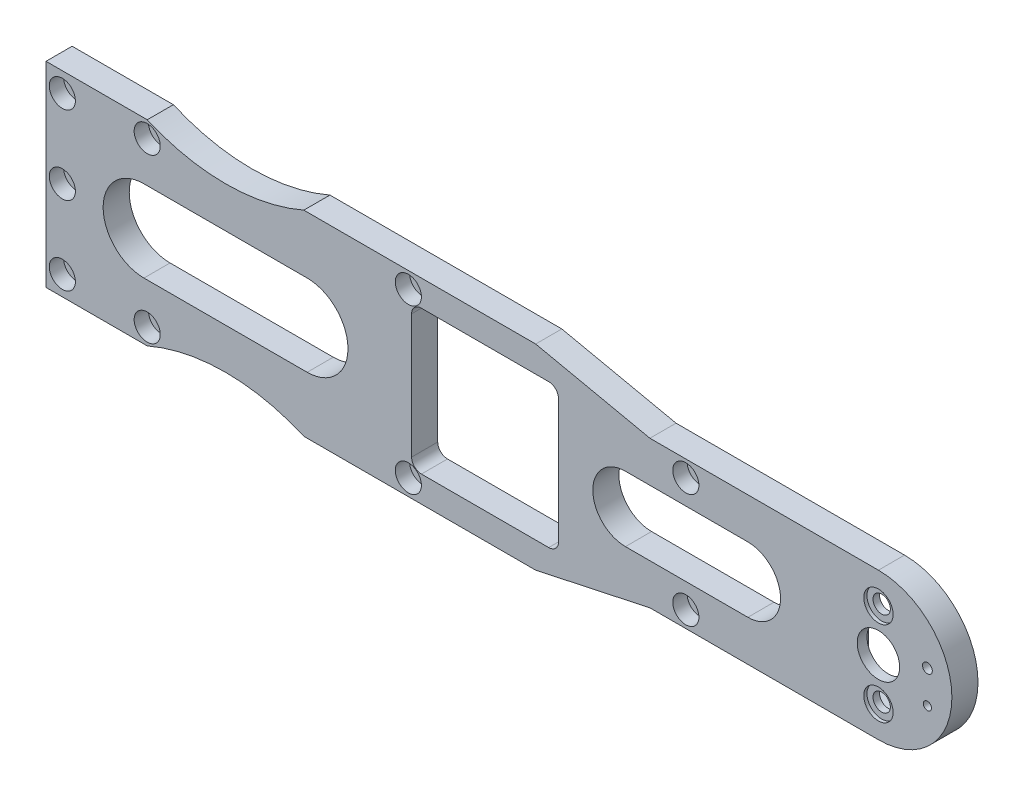
from build123d import *

# Parameters (mm, degrees)
SKETCH_1_W                   = 45
SKETCH_1_H                   = 44
EXTRUDE_1_DEPTH              = 8
CUT_EXTRUDE_1_DEPTH          = 10
FILLET_1_R                   = 3
HOLE_WIZARD_M4_1_D           = 4.5
HOLE_WIZARD_M4_1_CBORE_D     = 8
HOLE_WIZARD_M4_1_CBORE_DEPTH = 4.4
CUT_EXTRUDE_2_DEPTH          = 4
FILLET_2_R                   = 1.5
HOLE_WIZARD_13_0_13_1_D      = 13
HOLE_WIZARD_13_0_13_1_DEPTH  = 12
HOLE_WIZARD_13_0_13_1_TIP    = 3.905594024
CUT_EXTRUDE_3_DEPTH          = 5
HOLE_WIZARD_5_3_5_3_1_D      = 5.3
HOLE_WIZARD_5_3_5_3_1_DEPTH  = 12
HOLE_WIZARD_5_3_5_3_1_TIP    = 1.59228064
SKETCH_19_R                  = 4.5
CUT_EXTRUDE_4_DEPTH          = 1
HOLE_WIZARD_M3_1_D           = 2.5
HOLE_WIZARD_3_0_3_1_D        = 3
HOLE_WIZARD_3_0_3_1_DEPTH    = 40
HOLE_WIZARD_3_0_3_1_TIP      = 0.901290929
FILLET_3_R                   = 1.5


with BuildPart() as part:
    # 草图1 → 凸台-拉伸1 (new body)
    with BuildSketch(Plane.XY):
        with BuildLine():
            Line((128.173730269, 22.5), (58.173730269, 22.5))
            Line((58.173730269, 22.5), (23.173730269, 30))
            Line((23.173730269, 30), (-47.847112114, 30))
            ThreePointArc((-47.847112114, 30), (-71.826269731, 25), (-95.805427348, 30))
            Line((-95.805427348, 30), (-126.826269731, 30))
            Line((-126.826269731, 30), (-126.826269731, -30))
            Line((-126.826269731, -30), (-95.805427348, -30))
            ThreePointArc((-95.805427348, -30), (-71.826269731, -25), (-47.847112114, -30))
            Line((-47.847112114, -30), (23.173730269, -30))
            Line((23.173730269, -30), (58.173730269, -22.5))
            Line((58.173730269, -22.5), (128.173730269, -22.5))
            ThreePointArc((128.173730269, -22.5), (150.673730269, 0), (128.173730269, 22.5))
        make_face()
        with BuildLine():
            Line((-96.826269731, 12.5), (-46.826269731, 12.5))
            ThreePointArc((-46.826269731, 12.5), (-34.326269731, 0), (-46.826269731, -12.5))
            Line((-46.826269731, -12.5), (-96.826269731, -12.5))
            ThreePointArc((-96.826269731, -12.5), (-109.326269731, 0), (-96.826269731, 12.5))
        make_face(mode=Mode.SUBTRACT)
        with Locations((7.673730269, 0)):
            Rectangle(SKETCH_1_W, SKETCH_1_H, mode=Mode.SUBTRACT)
    extrude(amount=EXTRUDE_1_DEPTH)

    # 草图2 → 切除-拉伸1 (cut)
    with BuildSketch(Plane.XY.offset(8)):
        with BuildLine():
            Line((50.673730269, 10), (88.173730269, 10))
            ThreePointArc((88.173730269, 10), (98.173730269, 0), (88.173730269, -10))
            Line((88.173730269, -10), (50.673730269, -10))
            ThreePointArc((50.673730269, -10), (40.673730269, 0), (50.673730269, 10))
        make_face()
    extrude(amount=-CUT_EXTRUDE_1_DEPTH, mode=Mode.SUBTRACT)

    # 圆角1
    fillet_1_edges = [part.edges().sort_by_distance(p)[0] for p in [
        (-14.826269731, 22, 4),
        (-14.826269731, -22, 4),
        (30.173730269, -22, 4),
        (30.173730269, 22, 4),
    ]]
    fillet(fillet_1_edges, radius=FILLET_1_R)

    # M4 六角凹头螺钉的柱形沉头孔1 (through all)
    with Locations(Plane.XY.offset(8)):
        with Locations((-121.826269731, 0), (-121.826269731, -24), (-121.826269731, 24), (-95.826269731, 25), (-95.826269731, -25), (-15.826269731, -25), (-15.826269731, 25), (69.173730269, 17.5), (69.173730269, -17.5)):
            CounterBoreHole(HOLE_WIZARD_M4_1_D / 2, HOLE_WIZARD_M4_1_CBORE_D / 2, HOLE_WIZARD_M4_1_CBORE_DEPTH)

    # 草图11 → 切除-拉伸2 (cut)
    # profile 1 of 3: a face of its own
    with BuildSketch(Plane(origin=(0, 0, 0), x_dir=(-1, 0, 0), z_dir=(0, 0, -1))):
        with BuildLine():
            Line((24.826269731, -27), (47.229521978, -27))
            ThreePointArc((47.229521978, -27), (68.326801608, -22.097267763), (89.837715012, -24.629578112))
            ThreePointArc((89.837715012, -24.629578112), (96.011569063, -19.002862003), (101.826269731, -25))
            Line((101.826269731, -25), (101.826269731, -27))
            Line((101.826269731, -27), (114.826269731, -27))
            Line((114.826269731, -27), (114.826269731, 27))
            Line((114.826269731, 27), (101.826269731, 27))
            Line((101.826269731, 27), (101.826269731, 25))
            ThreePointArc((101.826269731, 25), (96.011569063, 19.002862003), (89.837715012, 24.629578112))
            ThreePointArc((89.837715012, 24.629578112), (68.326801608, 22.097267763), (47.229521978, 27))
            Line((47.229521978, 27), (24.826269731, 27))
            Line((24.826269731, 27), (24.826269731, -27))
        make_face()
        with BuildLine():
            Line((96.826269731, 15.5), (46.826269731, 15.5))
            ThreePointArc((46.826269731, 15.5), (31.326269731, 0), (46.826269731, -15.5))
            Line((46.826269731, -15.5), (96.826269731, -15.5))
            ThreePointArc((96.826269731, -15.5), (112.326269731, 0), (96.826269731, 15.5))
        make_face(mode=Mode.SUBTRACT)
    # profile 2 of 3: a face of its own
    with BuildSketch(Plane(origin=(0, 0, 0), x_dir=(-1, 0, 0), z_dir=(0, 0, -1))):
        with BuildLine():
            Line((-88.173730269, 20.25), (-115.477066498, 20.25))
            Line((-115.477066498, 20.25), (-115.477066498, 9.921609041))
            ThreePointArc((-115.477066498, 9.921609041), (-113.633917887, 6.945318766), (-112.477066498, 3.64120081))
            Line((-112.477066498, 3.64120081), (-100.65337997, 3.64120081))
            ThreePointArc((-100.65337997, 3.64120081), (-95.973229915, 10.400375246), (-88.173730269, 13))
            Line((-88.173730269, 13), (-88.173730269, 20.25))
        make_face()
    # profile 3 of 3: a face of its own
    with BuildSketch(Plane(origin=(0, 0, 0), x_dir=(-1, 0, 0), z_dir=(0, 0, -1))):
        with BuildLine():
            Line((-115.244901013, -19.5), (-88.173730269, -19.5))
            Line((-88.173730269, -19.5), (-88.173730269, -13))
            ThreePointArc((-88.173730269, -13), (-95.668248617, -10.622249984), (-100.421214485, -4.35879919))
            Line((-100.421214485, -4.35879919), (-112.244901013, -4.35879919))
            ThreePointArc((-112.244901013, -4.35879919), (-113.444814316, -7.468986993), (-115.244901013, -10.274828753))
            Line((-115.244901013, -10.274828753), (-115.244901013, -19.5))
        make_face()
    extrude(amount=-CUT_EXTRUDE_2_DEPTH, mode=Mode.SUBTRACT)

    # 圆角2
    fillet_2_edges = [part.edges().sort_by_distance(p)[0] for p in [
        (115.477066498, 9.921609041, 2),
        (115.477066498, 20.25, 2),
        (88.173730269, 20.25, 2),
        (88.173730269, 13, 2),
        (100.65337997, 3.64120081, 2),
        (112.477066498, 3.64120081, 2),
        (-24.826269731, -27, 2),
        (-24.826269731, 27, 2),
        (-47.229521978, 27, 2),
        (-89.837715012, 24.629578112, 2),
        (-101.826269731, 27, 2),
        (-114.826269731, 27, 2),
        (-114.826269731, -27, 2),
        (-101.826269731, -27, 2),
        (-89.837715012, -24.629578112, 2),
        (-47.229521978, -27, 2),
        (100.421214485, -4.35879919, 2),
        (88.173730269, -13, 2),
        (88.173730269, -19.5, 2),
        (115.244901013, -19.5, 2),
        (115.244901013, -10.274828753, 2),
        (112.244901013, -4.35879919, 2),
    ]]
    fillet(fillet_2_edges, radius=FILLET_2_R)

    # Ø13.0 (13) 直径孔1
    with Locations(Plane.XY.offset(8)):
        with Locations((128.173730269, 0)):
            Hole(HOLE_WIZARD_13_0_13_1_D / 2, depth=HOLE_WIZARD_13_0_13_1_DEPTH)
            with Locations((0, 0, -(HOLE_WIZARD_13_0_13_1_DEPTH + HOLE_WIZARD_13_0_13_1_TIP / 2))):  # 118° drill point
                Cone(0, HOLE_WIZARD_13_0_13_1_D / 2, HOLE_WIZARD_13_0_13_1_TIP, mode=Mode.SUBTRACT)

    # 草图14 → 切除-拉伸3 (cut)
    with BuildSketch(Plane(origin=(0, 0, 0), x_dir=(-1, 0, 0), z_dir=(0, 0, -1))):
        with BuildLine():
            Line((-139.173730269, 14.247806849), (-139.173730269, -14.247806849))
            ThreePointArc((-139.173730269, -14.247806849), (-128.173730269, -18), (-117.173730269, -14.247806849))
            Line((-117.173730269, -14.247806849), (-117.173730269, 14.247806849))
            ThreePointArc((-117.173730269, 14.247806849), (-128.173730269, 18), (-139.173730269, 14.247806849))
        make_face()
    extrude(amount=-CUT_EXTRUDE_3_DEPTH, mode=Mode.SUBTRACT)

    # Ø5.3 (5.3) 直径孔1
    with Locations(Plane.XY.offset(8)):
        with Locations((128.173730269, 13), (128.173730269, -13)):
            Hole(HOLE_WIZARD_5_3_5_3_1_D / 2, depth=HOLE_WIZARD_5_3_5_3_1_DEPTH)
            with Locations((0, 0, -(HOLE_WIZARD_5_3_5_3_1_DEPTH + HOLE_WIZARD_5_3_5_3_1_TIP / 2))):  # 118° drill point
                Cone(0, HOLE_WIZARD_5_3_5_3_1_D / 2, HOLE_WIZARD_5_3_5_3_1_TIP, mode=Mode.SUBTRACT)

    # 草图19 → 切除-拉伸4 (cut)
    with BuildSketch(Plane.XY.offset(8)):
        with Locations((128.173730269, 13)):
            Circle(SKETCH_19_R)
        with Locations((128.173730269, -13)):
            Circle(SKETCH_19_R)
    extrude(amount=-CUT_EXTRUDE_4_DEPTH, mode=Mode.SUBTRACT)

    # M3 螺纹孔1 (through all)
    with Locations(Plane.XY.offset(8)):
        with Locations((143.173730269, -6)):
            Hole(HOLE_WIZARD_M3_1_D / 2)

    # Ø3.0 (3) 直径孔1
    with Locations(Plane.XY.offset(8)):
        with Locations((143.173730269, 4)):
            Hole(HOLE_WIZARD_3_0_3_1_D / 2, depth=HOLE_WIZARD_3_0_3_1_DEPTH)
            with Locations((0, 0, -(HOLE_WIZARD_3_0_3_1_DEPTH + HOLE_WIZARD_3_0_3_1_TIP / 2))):  # 118° drill point
                Cone(0, HOLE_WIZARD_3_0_3_1_D / 2, HOLE_WIZARD_3_0_3_1_TIP, mode=Mode.SUBTRACT)

    # 圆角3
    fillet_3_edges = [part.edges().sort_by_distance(p)[0] for p in [
        (117.173730269, -14.247806849, 2.5),
        (139.173730269, -14.247806849, 2.5),
        (139.173730269, 14.247806849, 2.5),
        (117.173730269, 14.247806849, 2.5),
    ]]
    fillet(fillet_3_edges, radius=FILLET_3_R)


solid = part.part
